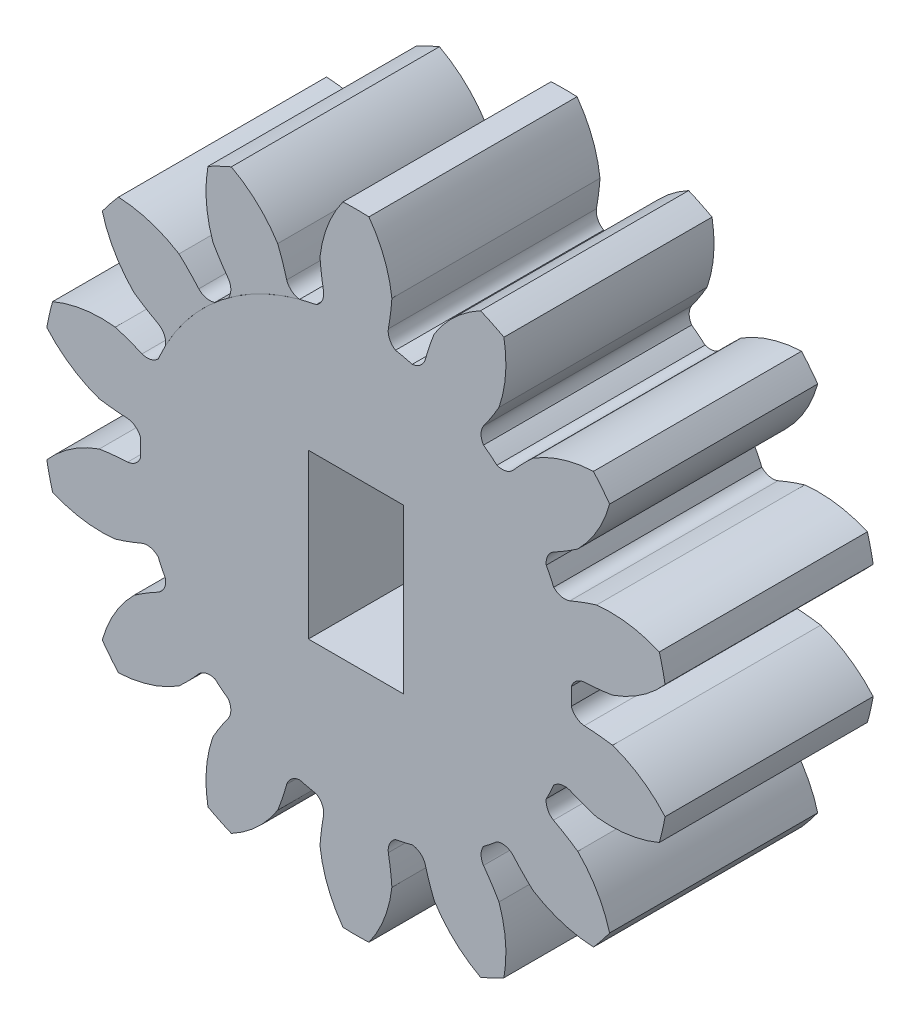
from build123d import *

# Parameters (mm, degrees)
BOSS_EXTRUDE1_DEPTH    = 7
BOSS_EXTRUDE1_2_DEPTH  = 7
BOSS_EXTRUDE1_3_DEPTH  = 7
BOSS_EXTRUDE1_4_DEPTH  = 7
BOSS_EXTRUDE1_5_DEPTH  = 7
BOSS_EXTRUDE1_6_DEPTH  = 7
BOSS_EXTRUDE1_7_DEPTH  = 7
BOSS_EXTRUDE1_8_DEPTH  = 7
BOSS_EXTRUDE1_9_DEPTH  = 7
BOSS_EXTRUDE1_10_DEPTH = 7
BOSS_EXTRUDE1_11_DEPTH = 7
BOSS_EXTRUDE1_12_DEPTH = 7
BOSS_EXTRUDE1_13_DEPTH = 7
BOSS_EXTRUDE1_14_DEPTH = 7
SKETCH1_R              = 7.25
BOSS_EXTRUDE2_DEPTH    = 7
SKETCH3_W              = 3.2
SKETCH3_H              = 5.5
CUT_EXTRUDE1_DEPTH     = 6


with BuildPart() as part:
    # Sketch2 → Boss-Extrude1 (new body)
    with BuildSketch(Plane.XY.offset(20)):
        with BuildLine():
            ThreePointArc((-0.43638137, 31.49092865), (0, 31.50135755), (0.43638137, 31.49092865))
            ThreePointArc((0.43638137, 31.49092865), (0.951639437, 30.546981097), (1.209067941, 29.502826691))
            ThreePointArc((1.209067941, 29.502826691), (1.162093587, 29.026837369), (1.088768363, 28.554189682))
            ThreePointArc((1.088768363, 28.554189682), (1.135140733, 28.267263714), (1.330539856, 28.052098451))
            ThreePointArc((1.330539856, 28.052098451), (0, 28.17523633), (-1.330539856, 28.052098451))
            ThreePointArc((-1.330539856, 28.052098451), (-1.135140733, 28.267263714), (-1.088768363, 28.554189682))
            ThreePointArc((-1.088768363, 28.554189682), (-1.162093587, 29.026837369), (-1.209067941, 29.502826691))
            ThreePointArc((-1.209067941, 29.502826691), (-0.951639437, 30.546981097), (-0.43638137, 31.49092865))
        make_face()
    extrude(amount=BOSS_EXTRUDE1_DEPTH)



with BuildPart() as body_2:
    # Sketch2 → Boss-Extrude1 2 (new body)
    with BuildSketch(Plane.XY.offset(20)):
        with BuildLine():
            ThreePointArc((1.893454598, 27.923616835), (3.145657109, 27.457260622), (4.291004573, 26.769017619))
            ThreePointArc((4.291004573, 26.769017619), (4.208312755, 27.047655325), (4.291025205, 27.326286906))
            ThreePointArc((4.291025205, 27.326286906), (4.562163095, 27.720313136), (4.811009552, 28.128783288))
            ThreePointArc((4.811009552, 28.128783288), (5.032116103, 29.181227943), (4.977448119, 30.255257398))
            ThreePointArc((4.977448119, 30.255257398), (4.58880702, 30.453992292), (4.191116061, 30.633934958))
            ThreePointArc((4.191116061, 30.633934958), (3.31732109, 30.007029697), (2.632344405, 29.177973126))
            ThreePointArc((2.632344405, 29.177973126), (2.468142809, 28.728740157), (2.329132406, 28.271084683))
            ThreePointArc((2.329132406, 28.271084683), (2.162859833, 28.032693536), (1.893454598, 27.923616835))
        make_face()
    extrude(amount=BOSS_EXTRUDE1_2_DEPTH)


with BuildPart() as body_3:
    # Sketch2 → Boss-Extrude1 3 (new body)
    with BuildSketch(Plane.XY.offset(20)):
        with BuildLine():
            ThreePointArc((4.742427147, 26.40902013), (5.668278248, 25.445537394), (6.401583208, 24.328504234))
            ThreePointArc((6.401583208, 24.328504234), (6.447976825, 24.615426767), (6.64339188, 24.830577561))
            ThreePointArc((6.64339188, 24.830577561), (7.058640251, 25.067940605), (7.460071718, 25.327989064))
            ThreePointArc((7.460071718, 25.327989064), (8.115920459, 26.180274396), (8.532670224, 27.171661048))
            ThreePointArc((8.532670224, 27.171661048), (8.268744532, 27.519340054), (7.988511556, 27.854014434))
            ThreePointArc((7.988511556, 27.854014434), (6.929245491, 27.66831774), (5.952388657, 27.218563825))
            ThreePointArc((5.952388657, 27.218563825), (5.609533251, 26.885063308), (5.285719938, 26.533044327))
            ThreePointArc((5.285719938, 26.533044327), (5.032479484, 26.390404291), (4.742427147, 26.40902013))
        make_face()
    extrude(amount=BOSS_EXTRUDE1_3_DEPTH)


with BuildPart() as body_4:
    # Sketch2 → Boss-Extrude1 4 (new body)
    with BuildSketch(Plane.XY.offset(20)):
        with BuildLine():
            ThreePointArc((6.652103837, 23.808292789), (7.068227363, 22.538513101), (7.244249779, 21.213931902))
            ThreePointArc((7.244249779, 21.213931902), (7.410540005, 21.452310736), (7.679953317, 21.561367488))
            ThreePointArc((7.679953317, 21.561367488), (8.157067136, 21.595054686), (8.631575189, 21.655175665))
            ThreePointArc((8.631575189, 21.655175665), (9.592267234, 22.138496112), (10.397892344, 22.850883675))
            ThreePointArc((10.397892344, 22.850883675), (10.31095578, 23.278644701), (10.203684364, 23.701764431))
            ThreePointArc((10.203684364, 23.701764431), (9.168747841, 23.994055812), (8.093489334, 24.012683831))
            ThreePointArc((8.093489334, 24.012683831), (7.639886836, 23.860969634), (7.195405811, 23.684308822))
            ThreePointArc((7.195405811, 23.684308822), (6.905354853, 23.665671505), (6.652103837, 23.808292789))
        make_face()
    extrude(amount=BOSS_EXTRUDE1_4_DEPTH)


with BuildPart() as body_5:
    # Sketch2 → Boss-Extrude1 5 (new body)
    with BuildSketch(Plane.XY.offset(20)):
        with BuildLine():
            ThreePointArc((7.244249779, 20.636540758), (7.068227363, 19.311959559), (6.652103837, 18.042179871))
            ThreePointArc((6.652103837, 18.042179871), (6.905354853, 18.184801155), (7.195405811, 18.166163838))
            ThreePointArc((7.195405811, 18.166163838), (7.639886836, 17.989503026), (8.093489334, 17.837788829))
            ThreePointArc((8.093489334, 17.837788829), (9.168747841, 17.856416849), (10.203684364, 18.148708229))
            ThreePointArc((10.203684364, 18.148708229), (10.31095578, 18.571827959), (10.397892344, 18.999588985))
            ThreePointArc((10.397892344, 18.999588985), (9.592267234, 19.711976548), (8.631575189, 20.195296995))
            ThreePointArc((8.631575189, 20.195296995), (8.157067136, 20.255417974), (7.679953317, 20.289105172))
            ThreePointArc((7.679953317, 20.289105172), (7.410540005, 20.398161924), (7.244249779, 20.636540758))
        make_face()
    extrude(amount=BOSS_EXTRUDE1_5_DEPTH)


with BuildPart() as body_6:
    # Sketch2 → Boss-Extrude1 6 (new body)
    with BuildSketch(Plane.XY.offset(20)):
        with BuildLine():
            ThreePointArc((6.401583208, 17.521968426), (5.668278248, 16.404935267), (4.742427147, 15.441452531))
            ThreePointArc((4.742427147, 15.441452531), (5.032479484, 15.460068369), (5.285719938, 15.317428333))
            ThreePointArc((5.285719938, 15.317428333), (5.609533251, 14.965409352), (5.952388657, 14.631908835))
            ThreePointArc((5.952388657, 14.631908835), (6.929245491, 14.18215492), (7.988511556, 13.996458226))
            ThreePointArc((7.988511556, 13.996458226), (8.268744532, 14.331132606), (8.532670224, 14.678811612))
            ThreePointArc((8.532670224, 14.678811612), (8.115920459, 15.670198264), (7.460071718, 16.522483596))
            ThreePointArc((7.460071718, 16.522483596), (7.058640251, 16.782532055), (6.64339188, 17.0198951))
            ThreePointArc((6.64339188, 17.0198951), (6.447976825, 17.235045893), (6.401583208, 17.521968426))
        make_face()
    extrude(amount=BOSS_EXTRUDE1_6_DEPTH)


with BuildPart() as body_7:
    # Sketch2 → Boss-Extrude1 7 (new body)
    with BuildSketch(Plane.XY.offset(20)):
        with BuildLine():
            ThreePointArc((4.291004573, 15.081455041), (3.145657109, 14.393212038), (1.893454598, 13.926855826))
            ThreePointArc((1.893454598, 13.926855826), (2.162859833, 13.817779124), (2.329132406, 13.579387977))
            ThreePointArc((2.329132406, 13.579387977), (2.468142809, 13.121732503), (2.632344405, 12.672499535))
            ThreePointArc((2.632344405, 12.672499535), (3.31732109, 11.843442963), (4.191116061, 11.216537702))
            ThreePointArc((4.191116061, 11.216537702), (4.58880702, 11.396480368), (4.977448119, 11.595215262))
            ThreePointArc((4.977448119, 11.595215262), (5.032116103, 12.669244717), (4.811009552, 13.721689372))
            ThreePointArc((4.811009552, 13.721689372), (4.562163095, 14.130159524), (4.291025205, 14.524185754))
            ThreePointArc((4.291025205, 14.524185754), (4.208312755, 14.802817335), (4.291004573, 15.081455041))
        make_face()
    extrude(amount=BOSS_EXTRUDE1_7_DEPTH)


with BuildPart() as body_8:
    # Sketch2 → Boss-Extrude1 8 (new body)
    with BuildSketch(Plane.XY.offset(20)):
        with BuildLine():
            ThreePointArc((1.330539856, 13.798374209), (0, 13.67523633), (-1.330539856, 13.798374209))
            ThreePointArc((-1.330539856, 13.798374209), (-1.135140733, 13.583208946), (-1.088768363, 13.296282978))
            ThreePointArc((-1.088768363, 13.296282978), (-1.162093587, 12.823635291), (-1.209067941, 12.347645969))
            ThreePointArc((-1.209067941, 12.347645969), (-0.951639437, 11.303491563), (-0.43638137, 10.35954401))
            ThreePointArc((-0.43638137, 10.35954401), (0, 10.34911511), (0.43638137, 10.35954401))
            ThreePointArc((0.43638137, 10.35954401), (0.951639437, 11.303491563), (1.209067941, 12.347645969))
            ThreePointArc((1.209067941, 12.347645969), (1.162093587, 12.823635291), (1.088768363, 13.296282978))
            ThreePointArc((1.088768363, 13.296282978), (1.135140733, 13.583208946), (1.330539856, 13.798374209))
        make_face()
    extrude(amount=BOSS_EXTRUDE1_8_DEPTH)


with BuildPart() as body_9:
    # Sketch2 → Boss-Extrude1 9 (new body)
    with BuildSketch(Plane.XY.offset(20)):
        with BuildLine():
            ThreePointArc((-1.893454598, 13.926855826), (-3.145657109, 14.393212038), (-4.291004573, 15.081455041))
            ThreePointArc((-4.291004573, 15.081455041), (-4.208312755, 14.802817335), (-4.291025205, 14.524185754))
            ThreePointArc((-4.291025205, 14.524185754), (-4.562163095, 14.130159524), (-4.811009552, 13.721689372))
            ThreePointArc((-4.811009552, 13.721689372), (-5.032116103, 12.669244717), (-4.977448119, 11.595215262))
            ThreePointArc((-4.977448119, 11.595215262), (-4.58880702, 11.396480368), (-4.191116061, 11.216537702))
            ThreePointArc((-4.191116061, 11.216537702), (-3.31732109, 11.843442963), (-2.632344405, 12.672499535))
            ThreePointArc((-2.632344405, 12.672499535), (-2.468142809, 13.121732503), (-2.329132406, 13.579387977))
            ThreePointArc((-2.329132406, 13.579387977), (-2.162859833, 13.817779124), (-1.893454598, 13.926855826))
        make_face()
    extrude(amount=BOSS_EXTRUDE1_9_DEPTH)


with BuildPart() as body_10:
    # Sketch2 → Boss-Extrude1 10 (new body)
    with BuildSketch(Plane.XY.offset(20)):
        with BuildLine():
            ThreePointArc((-4.742427147, 15.441452531), (-5.668278248, 16.404935267), (-6.401583208, 17.521968426))
            ThreePointArc((-6.401583208, 17.521968426), (-6.447976825, 17.235045893), (-6.64339188, 17.0198951))
            ThreePointArc((-6.64339188, 17.0198951), (-7.058640251, 16.782532055), (-7.460071718, 16.522483596))
            ThreePointArc((-7.460071718, 16.522483596), (-8.115920459, 15.670198264), (-8.532670224, 14.678811612))
            ThreePointArc((-8.532670224, 14.678811612), (-8.268744532, 14.331132606), (-7.988511556, 13.996458226))
            ThreePointArc((-7.988511556, 13.996458226), (-6.929245491, 14.18215492), (-5.952388657, 14.631908835))
            ThreePointArc((-5.952388657, 14.631908835), (-5.609533251, 14.965409352), (-5.285719938, 15.317428333))
            ThreePointArc((-5.285719938, 15.317428333), (-5.032479484, 15.460068369), (-4.742427147, 15.441452531))
        make_face()
    extrude(amount=BOSS_EXTRUDE1_10_DEPTH)


with BuildPart() as body_11:
    # Sketch2 → Boss-Extrude1 11 (new body)
    with BuildSketch(Plane.XY.offset(20)):
        with BuildLine():
            ThreePointArc((-6.652103837, 18.042179871), (-7.068227363, 19.311959559), (-7.244249779, 20.636540758))
            ThreePointArc((-7.244249779, 20.636540758), (-7.410540005, 20.398161924), (-7.679953317, 20.289105172))
            ThreePointArc((-7.679953317, 20.289105172), (-8.157067136, 20.255417974), (-8.631575189, 20.195296995))
            ThreePointArc((-8.631575189, 20.195296995), (-9.592267234, 19.711976548), (-10.397892344, 18.999588985))
            ThreePointArc((-10.397892344, 18.999588985), (-10.31095578, 18.571827959), (-10.203684364, 18.148708229))
            ThreePointArc((-10.203684364, 18.148708229), (-9.168747841, 17.856416849), (-8.093489334, 17.837788829))
            ThreePointArc((-8.093489334, 17.837788829), (-7.639886836, 17.989503026), (-7.195405811, 18.166163838))
            ThreePointArc((-7.195405811, 18.166163838), (-6.905354853, 18.184801155), (-6.652103837, 18.042179871))
        make_face()
    extrude(amount=BOSS_EXTRUDE1_11_DEPTH)


with BuildPart() as body_12:
    # Sketch2 → Boss-Extrude1 12 (new body)
    with BuildSketch(Plane.XY.offset(20)):
        with BuildLine():
            ThreePointArc((-7.244249779, 21.213931902), (-7.068227363, 22.538513101), (-6.652103837, 23.808292789))
            ThreePointArc((-6.652103837, 23.808292789), (-6.905354853, 23.665671505), (-7.195405811, 23.684308822))
            ThreePointArc((-7.195405811, 23.684308822), (-7.639886836, 23.860969634), (-8.093489334, 24.012683831))
            ThreePointArc((-8.093489334, 24.012683831), (-9.168747841, 23.994055812), (-10.203684364, 23.701764431))
            ThreePointArc((-10.203684364, 23.701764431), (-10.31095578, 23.278644701), (-10.397892344, 22.850883675))
            ThreePointArc((-10.397892344, 22.850883675), (-9.592267234, 22.138496112), (-8.631575189, 21.655175665))
            ThreePointArc((-8.631575189, 21.655175665), (-8.157067136, 21.595054686), (-7.679953317, 21.561367488))
            ThreePointArc((-7.679953317, 21.561367488), (-7.410540005, 21.452310736), (-7.244249779, 21.213931902))
        make_face()
    extrude(amount=BOSS_EXTRUDE1_12_DEPTH)


with BuildPart() as body_13:
    # Sketch2 → Boss-Extrude1 13 (new body)
    with BuildSketch(Plane.XY.offset(20)):
        with BuildLine():
            ThreePointArc((-6.401583208, 24.328504234), (-5.668278248, 25.445537394), (-4.742427147, 26.40902013))
            ThreePointArc((-4.742427147, 26.40902013), (-5.032479484, 26.390404291), (-5.285719938, 26.533044327))
            ThreePointArc((-5.285719938, 26.533044327), (-5.609533251, 26.885063308), (-5.952388657, 27.218563825))
            ThreePointArc((-5.952388657, 27.218563825), (-6.929245491, 27.66831774), (-7.988511556, 27.854014434))
            ThreePointArc((-7.988511556, 27.854014434), (-8.268744532, 27.519340054), (-8.532670224, 27.171661048))
            ThreePointArc((-8.532670224, 27.171661048), (-8.115920459, 26.180274396), (-7.460071718, 25.327989064))
            ThreePointArc((-7.460071718, 25.327989064), (-7.058640251, 25.067940605), (-6.64339188, 24.830577561))
            ThreePointArc((-6.64339188, 24.830577561), (-6.447976825, 24.615426767), (-6.401583208, 24.328504234))
        make_face()
    extrude(amount=BOSS_EXTRUDE1_13_DEPTH)


with BuildPart() as body_14:
    # Sketch2 → Boss-Extrude1 14 (new body)
    with BuildSketch(Plane.XY.offset(20)):
        with BuildLine():
            ThreePointArc((-4.291004573, 26.769017619), (-3.145657109, 27.457260622), (-1.893454598, 27.923616835))
            ThreePointArc((-1.893454598, 27.923616835), (-2.162859833, 28.032693536), (-2.329132406, 28.271084683))
            ThreePointArc((-2.329132406, 28.271084683), (-2.468142809, 28.728740157), (-2.632344405, 29.177973126))
            ThreePointArc((-2.632344405, 29.177973126), (-3.31732109, 30.007029697), (-4.191116061, 30.633934958))
            ThreePointArc((-4.191116061, 30.633934958), (-4.58880702, 30.453992292), (-4.977448119, 30.255257398))
            ThreePointArc((-4.977448119, 30.255257398), (-5.032116103, 29.181227943), (-4.811009552, 28.128783288))
            ThreePointArc((-4.811009552, 28.128783288), (-4.562163095, 27.720313136), (-4.291025205, 27.326286906))
            ThreePointArc((-4.291025205, 27.326286906), (-4.208312755, 27.047655325), (-4.291004573, 26.769017619))
        make_face()
    extrude(amount=BOSS_EXTRUDE1_14_DEPTH)


with BuildPart() as part_1:
    add(part.part)

    add(body_2.part)  # Boss-Extrude2 merges body 2

    add(body_3.part)  # Boss-Extrude2 merges body 3

    add(body_4.part)  # Boss-Extrude2 merges body 4

    add(body_5.part)  # Boss-Extrude2 merges body 5

    add(body_6.part)  # Boss-Extrude2 merges body 6

    add(body_7.part)  # Boss-Extrude2 merges body 7

    add(body_8.part)  # Boss-Extrude2 merges body 8

    add(body_9.part)  # Boss-Extrude2 merges body 9

    add(body_10.part)  # Boss-Extrude2 merges body 10

    add(body_11.part)  # Boss-Extrude2 merges body 11

    add(body_12.part)  # Boss-Extrude2 merges body 12
    # Sketch1 → Boss-Extrude2 (add)
    with BuildSketch(Plane.XY.offset(20)):
        with Locations((0, 20.92523633)):
            Circle(SKETCH1_R)
    extrude(amount=BOSS_EXTRUDE2_DEPTH)

    # Sketch3 → Cut-Extrude1 (cut)
    with BuildSketch(Plane.XY.offset(27)):
        with Locations((0, 20.92523633)):
            Rectangle(SKETCH3_W, SKETCH3_H)
    extrude(amount=-CUT_EXTRUDE1_DEPTH, mode=Mode.SUBTRACT)


solid = Compound([body_13.part, body_14.part, part_1.part])
